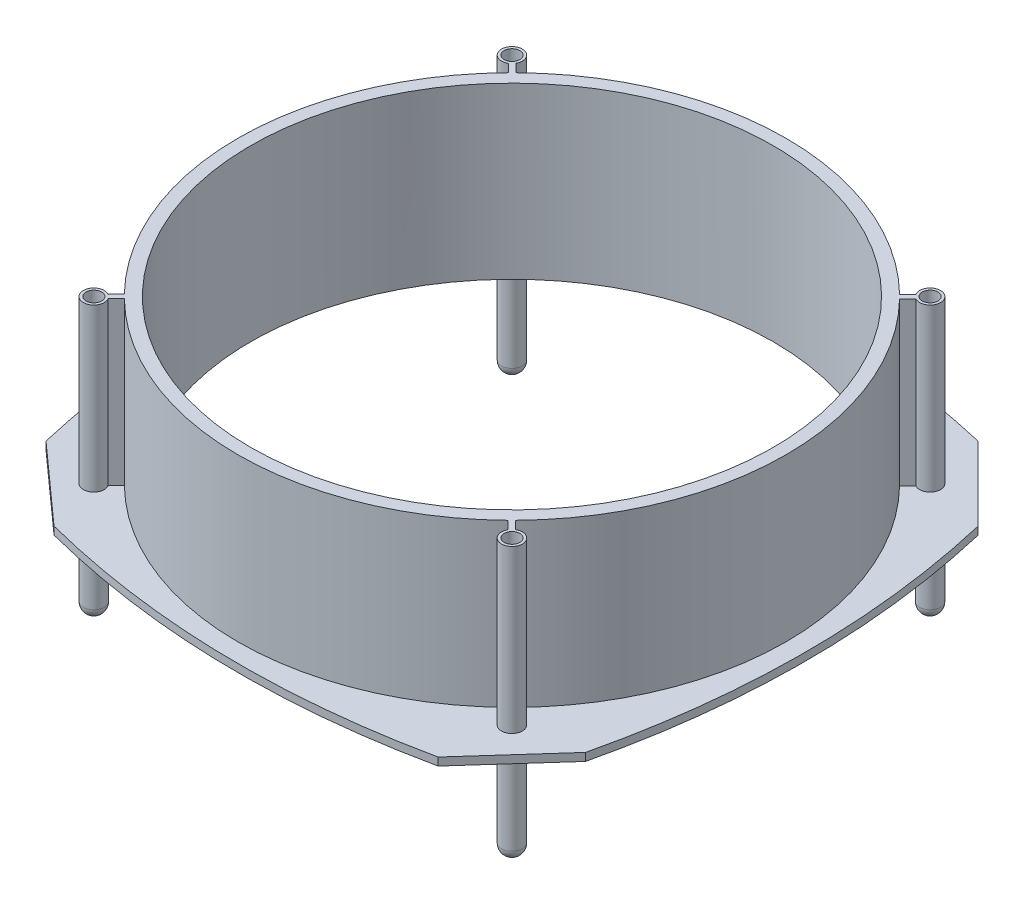
from build123d import *

# Parameters (mm, degrees)
SKETCH2_R                = 5000
BOSS_EXTRUDE2_DEPTH      = 150
SKETCH3_R                = 5244.246539356
BOSS_EXTRUDE3_DEPTH      = 3250
SKETCH7_R                = 2
BOSS_EXTRUDE12_DEPTH     = 3250
SKETCH9_R                = 200
BOSS_EXTRUDE13_DEPTH     = 2000
FILLET1_R                = 200
CIRPATTERN7_COUNT        = 4
FILLET1_OF_CIRPATTERN7_R = 200
SCALE2_SCALE             = 0.01
SKETCH14_R               = 50
CUT_EXTRUDE4_DEPTH       = 96.047197338
BOSS_EXTRUDE14_START     = -32.5
SKETCH7_6_R              = 2
BOSS_EXTRUDE14_DEPTH     = 32.5
EXTRUDE_THIN10_DEPTH     = 31
SKETCH15_R               = 1.5
CUT_EXTRUDE5_DEPTH       = 7.5
CIRPATTERN1_COUNT        = 4


with BuildPart() as part:
    # Sketch2 → Boss-Extrude2 (new body)
    with BuildSketch(Plane(origin=(0, 0, 0), x_dir=(1, 0, 0), z_dir=(0, 1, 0))):
        with BuildLine():
            Line((3824.429393628, -5236.727592336), (5157.692676049, -3749.624245316))
            add(Edge.make_bspline(
                [(5163.968520998, 3752.344435712), (6040.866701019, 0.596942764), (5157.692676049, -3749.624245316)],
                knots=[0, 0, 0, 1, 1, 1], degree=2))
            Line((5163.968520998, 3752.344435712), (3751.208948661, 5164.143902966))
            add(Edge.make_bspline(
                [(-3751.770188441, 5163.582833105), (-0.337562444, 6037.385508755), (3751.208948661, 5164.143902966)],
                knots=[0, 0, 0, 1, 1, 1], degree=2))
            Line((-3751.770188441, 5163.582833105), (-5163.707873982, 3750.961398637))
            add(Edge.make_bspline(
                [(-5163.707873982, 3750.961398637), (-6037.549572471, -0.53895869), (-5163.076160475, -3751.919756157)],
                knots=[0, 0, 0, 1, 1, 1], degree=2))
            Line((-5163.076160475, -3751.919756157), (-3675.972813455, -5085.183038578))
            add(Edge.make_bspline(
                [(-3675.972813455, -5085.183038578), (54.671333271, -6041.022726245), (3824.429393628, -5236.727592336)],
                knots=[0, 0, 0, 1, 1, 1], degree=2))
        make_face()
        Circle(SKETCH2_R, mode=Mode.SUBTRACT)
    extrude(amount=BOSS_EXTRUDE2_DEPTH)

    # Sketch3 → Boss-Extrude3 (add)
    with BuildSketch(Plane(origin=(0, 0, 0), x_dir=(1, 0, 0), z_dir=(0, 1, 0))):
        Circle(SKETCH3_R)
    extrude(amount=BOSS_EXTRUDE3_DEPTH)

    # Sketch7 → Boss-Extrude12 (add)
    with BuildSketch(Plane(origin=(0, 0, 0), x_dir=(-1, 0, 0), z_dir=(0, -1, 0))):
        with Locations((40, 40)):
            Circle(SKETCH7_R)
    extrude(amount=-BOSS_EXTRUDE12_DEPTH)

    # Sketch9 → Boss-Extrude13 (add)
    with BuildSketch(Plane(origin=(0, 0, 0), x_dir=(-1, 0, 0), z_dir=(0, -1, 0))):
        with Locations((4000, 4000)):
            Circle(SKETCH9_R)
    boss_extrude13 = extrude(amount=BOSS_EXTRUDE13_DEPTH)

    # Fillet1
    fillet1_edges = [part.edges().sort_by_distance(p)[0] for p in [
        (-3800, 0, -4000),
        (-3800, -2000, -4000),
    ]]
    fillet(fillet1_edges, radius=FILLET1_R)

    # CirPattern7: Boss-Extrude13 ×4 about axis
    cirpattern7_axis = Axis((0, 3512.5, 0), (0, -1, 0))
    for i in range(1, CIRPATTERN7_COUNT):
        add(boss_extrude13.rotate(cirpattern7_axis, i * 360 / CIRPATTERN7_COUNT))

    # Fillet1 of CirPattern7
    fillet1_of_cirpattern7_edges = [part.edges().sort_by_distance(p)[0] for p in [
        (4000, 0, -3800),
        (4000, -2000, -3800),
        (3800, 0, 4000),
        (3800, -2000, 4000),
        (-4000, 0, 3800),
        (-4000, -2000, 3800),
    ]]
    fillet(fillet1_of_cirpattern7_edges, radius=FILLET1_OF_CIRPATTERN7_R)


with BuildPart() as part_1:
    # Scale2: scaled about (0, 0, 0)
    add(part.part.scale(SCALE2_SCALE))

    # Sketch14 → Cut-Extrude4 (cut, through all)
    with BuildSketch(Plane(origin=(0, 32.5, 0), x_dir=(1, 0, 0), z_dir=(0, 1, 0))):
        Circle(SKETCH14_R)
    extrude(amount=-CUT_EXTRUDE4_DEPTH, mode=Mode.SUBTRACT)

    # Sketch7<6> → Boss-Extrude14 (add)
    with BuildSketch(Plane(origin=(0, 0, 0), x_dir=(-1, 0, 0), z_dir=(0, -1, 0)).offset(BOSS_EXTRUDE14_START)):
        with Locations((40, 40)):
            Circle(SKETCH7_6_R)
    boss_extrude14 = extrude(amount=BOSS_EXTRUDE14_DEPTH)

    # Sketch16 → Extrude-Thin10 (add)
    with BuildSketch(Plane(origin=(0, 1.5, 0), x_dir=(1, 0, 0), z_dir=(0, 1, 0))):
        Polygon((-38.262874695, 39.008841247), (-36.687839251, 37.472851875), (-37.386016238, 36.756926674), (-38.961051682, 38.292916046), align=None)
    extrude_thin10 = extrude(amount=EXTRUDE_THIN10_DEPTH)

    # Sketch15 → Cut-Extrude5 (cut)
    with BuildSketch(Plane(origin=(0, 32.5, 0), x_dir=(1, 0, 0), z_dir=(0, 1, 0))):
        with Locations((-40, 40)):
            Circle(SKETCH15_R)
    cut_extrude5 = extrude(amount=-CUT_EXTRUDE5_DEPTH, mode=Mode.SUBTRACT)

    # CirPattern1: Boss-Extrude14, Extrude-Thin10, Cut-Extrude5 ×4 about axis
    cirpattern1_axis = Axis((0, 3512.5, 0), (0, -1, 0))
    add([boss_extrude14.rotate(cirpattern1_axis, i * 360 / CIRPATTERN1_COUNT) for i in range(1, CIRPATTERN1_COUNT)])
    add([extrude_thin10.rotate(cirpattern1_axis, i * 360 / CIRPATTERN1_COUNT) for i in range(1, CIRPATTERN1_COUNT)])
    add([cut_extrude5.rotate(cirpattern1_axis, i * 360 / CIRPATTERN1_COUNT) for i in range(1, CIRPATTERN1_COUNT)], mode=Mode.SUBTRACT)


solid = part_1.part
